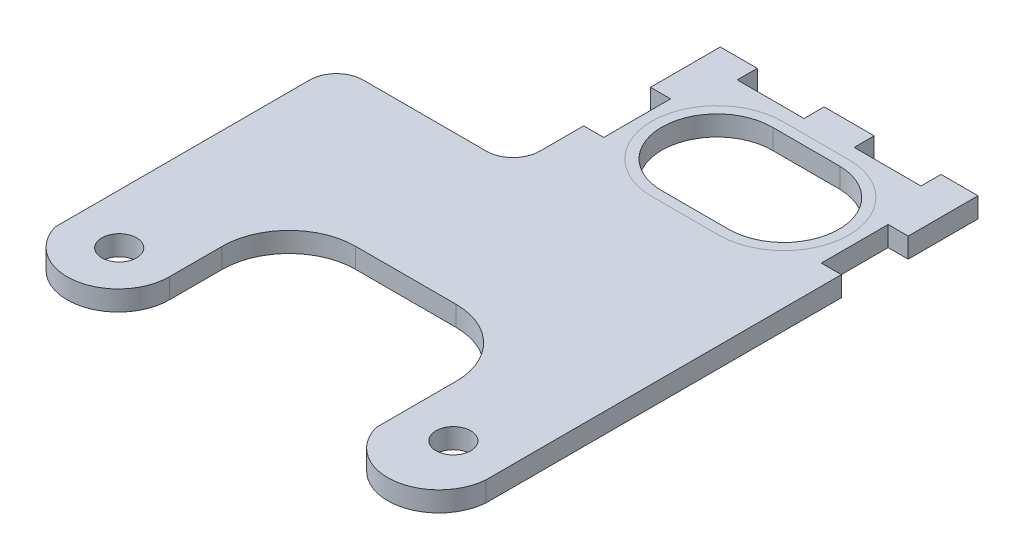
from build123d import *

# Parameters (mm, degrees)
SKETCH1_R           = 2.6
BOSS_EXTRUDE1_DEPTH = 3
SKETCH2_W           = 10
SKETCH2_H           = 3
SKETCH2_W_2         = 3
SKETCH2_H_2         = 10
CUT_EXTRUDE1_DEPTH  = 3
BOSS_EXTRUDE2_DEPTH = 3


with BuildPart() as part:
    # Sketch1 → Boss-Extrude1 (new body)
    with BuildSketch(Plane(origin=(0, 0, 0), x_dir=(1, 0, 0), z_dir=(0, 1, 0))):
        with BuildLine():
            Line((-32.5, -1.331915835), (-32.5, -34.437048929))
            ThreePointArc((-32.5, -34.437048929), (-24.085532921, -39.90046288), (-17.5, -32.331915835))
            Line((-17.5, -32.331915835), (-17.5, -24.442231617))
            ThreePointArc((-17.5, -24.442231617), (-14.571067812, -17.371163805), (-7.5, -14.442231617))
            Line((-7.5, -14.442231617), (7.5, -14.442231617))
            ThreePointArc((7.5, -14.442231617), (14.571067812, -17.371163805), (17.5, -24.442231617))
            Line((17.5, -24.442231617), (17.5, -32.331915835))
            Line((17.5, -32.331915835), (17.5, -36.417098288))
            ThreePointArc((17.5, -36.417098288), (25.631797985, -41.985078136), (32.5, -34.917098288))
            Line((32.5, -34.917098288), (32.5, -33.831915835))
            Line((32.5, -33.831915835), (32.5, -1.331915835))
            Line((32.5, -1.331915835), (32.5, 3.668084165))
            Line((32.5, 3.668084165), (32.5, 38.668084165))
            Line((32.5, 38.668084165), (32.441371292, 38.668084165))
            Line((32.441371292, 38.668084165), (-6.058628708, 38.668084165))
            Line((-6.058628708, 38.668084165), (-6.058628708, 14.168084165))
            Line((-6.058628708, 14.168084165), (-6.058628708, 11.668084165))
            ThreePointArc((-6.058628708, 11.668084165), (-7.230201584, 8.83965704), (-10.058628708, 7.668084165))
            Line((-10.058628708, 7.668084165), (-28.5, 7.668084165))
            ThreePointArc((-28.5, 7.668084165), (-31.328427125, 6.49651129), (-32.5, 3.668084165))
            Line((-32.5, 3.668084165), (-32.5, 3.101498414))
            Line((-32.5, 3.101498414), (-32.5, -1.331915835))
        make_face()
        with Locations(Location((-25, -32.331915835, 0), (0, 0, 270))):
            Circle(SKETCH1_R, mode=Mode.SUBTRACT)
        with Locations(Location((25, -32.331915835, 0), (0, 0, 270))):
            Circle(SKETCH1_R, mode=Mode.SUBTRACT)
        with BuildLine():
            ThreePointArc((8.344321377, 14.168084165), (8.192552441, 14.166903015), (8.040783506, 14.168084165))
            ThreePointArc((8.040783506, 14.168084165), (-1.558628708, 23.918084165), (8.040783506, 33.668084165))
            ThreePointArc((8.040783506, 33.668084165), (8.192552441, 33.669265314), (8.344321377, 33.668084165))
            Line((8.344321377, 33.668084165), (18.341959078, 33.668084165))
            ThreePointArc((18.341959078, 33.668084165), (27.941371292, 23.918084165), (18.341959078, 14.168084165))
            Line((18.341959078, 14.168084165), (8.344321377, 14.168084165))
        make_face(mode=Mode.SUBTRACT)
    extrude(amount=BOSS_EXTRUDE1_DEPTH)

    # Sketch2 → Cut-Extrude1 (cut)
    with BuildSketch(Plane(origin=(0, 3, 0), x_dir=(1, 0, 0), z_dir=(0, 1, 0))):
        with Locations((4.470685646, 37.168084165)):
            Rectangle(SKETCH2_W, SKETCH2_H)
        with Locations((-4.558628708, 23.22062572)):
            Rectangle(SKETCH2_W_2, SKETCH2_H_2)
        with Locations((21.970685646, 37.168084165)):
            Rectangle(SKETCH2_W, SKETCH2_H)
        with Locations((31, 23.22062572)):
            Rectangle(SKETCH2_W_2, SKETCH2_H_2)
    extrude(amount=-CUT_EXTRUDE1_DEPTH, mode=Mode.SUBTRACT)


with BuildPart() as body_2:
    # Sketch4 → Boss-Extrude2 (new body)
    with BuildSketch(Plane(origin=(0, 3, 0), x_dir=(1, 0, 0), z_dir=(0, 1, 0))):
        with BuildLine():
            ThreePointArc((8.344321377, 33.668084165), (-1.558628708, 23.918084165), (8.344321377, 14.168084165))
            Line((8.344321377, 14.168084165), (18.341959078, 14.168084165))
            ThreePointArc((18.341959078, 14.168084165), (27.941371292, 23.918084165), (18.341959078, 33.668084165))
            Line((18.341959078, 33.668084165), (8.344321377, 33.668084165))
        make_face()
        with BuildLine():
            ThreePointArc((8.332160325, 15.668084165), (-0.058628708, 23.918084165), (8.332160325, 32.168084165))
            Line((8.332160325, 32.168084165), (18.329798027, 32.168084165))
            ThreePointArc((18.329798027, 32.168084165), (26.441371292, 23.918084165), (18.329798027, 15.668084165))
            Line((18.329798027, 15.668084165), (8.332160325, 15.668084165))
        make_face(mode=Mode.SUBTRACT)
    extrude(amount=-BOSS_EXTRUDE2_DEPTH)


solid = Compound([part.part, body_2.part])
